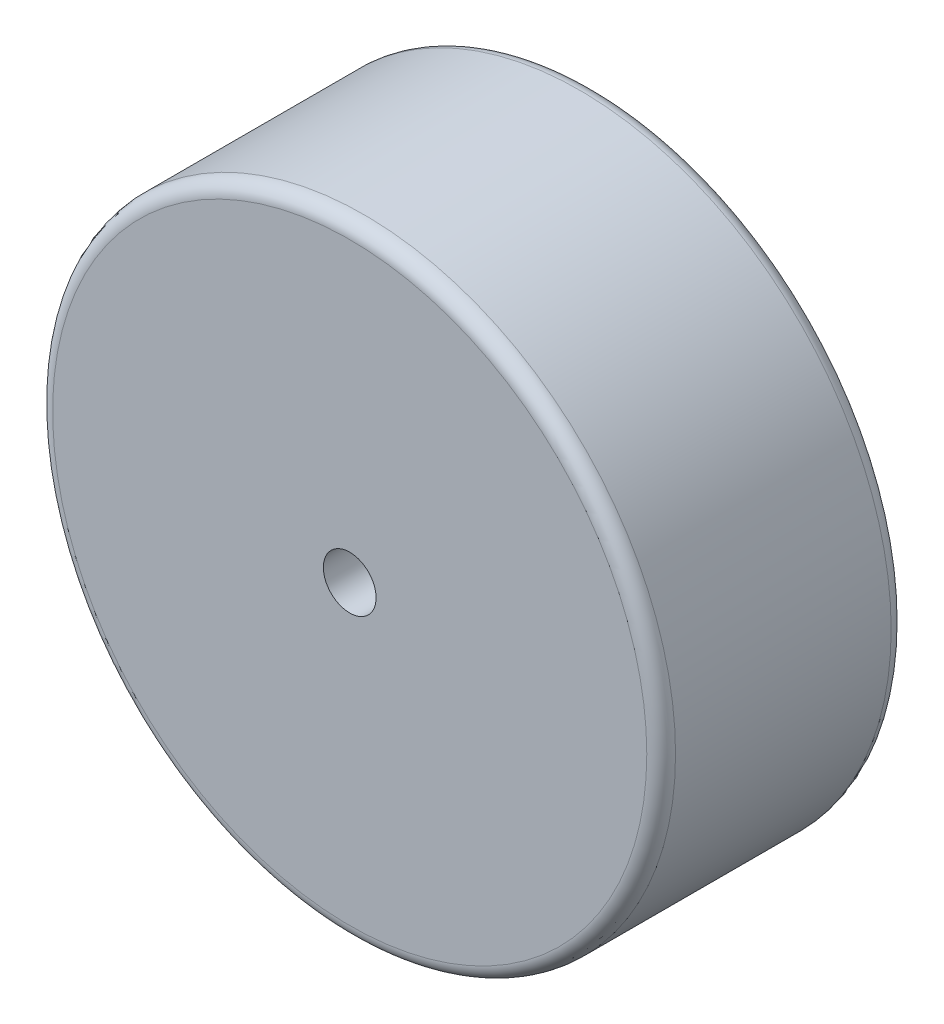
from build123d import *

# Parameters (mm, degrees)
SKETCH_1_R          = 65
EXTRUDE_1_DEPTH     = 51
SKETCH_2_R          = 5.5
CUT_EXTRUDE_1_DEPTH = 106.123736615
FILLET_1_R          = 3


with BuildPart() as part:
    # 草图1 → 凸台-拉伸1 (new body)
    with BuildSketch(Plane.XY):
        Circle(SKETCH_1_R)
    extrude(amount=EXTRUDE_1_DEPTH)

    # 草图2 → 切除-拉伸1 (cut, through all)
    with BuildSketch(Plane.XY.offset(51)):
        Circle(SKETCH_2_R)
    extrude(amount=-CUT_EXTRUDE_1_DEPTH, mode=Mode.SUBTRACT)

    # 圆角1
    fillet_1_edges = [part.edges().sort_by_distance(p)[0] for p in [
        (-65, 0, 0),
        (-65, 0, 51),
    ]]
    fillet(fillet_1_edges, radius=FILLET_1_R)


solid = part.part
